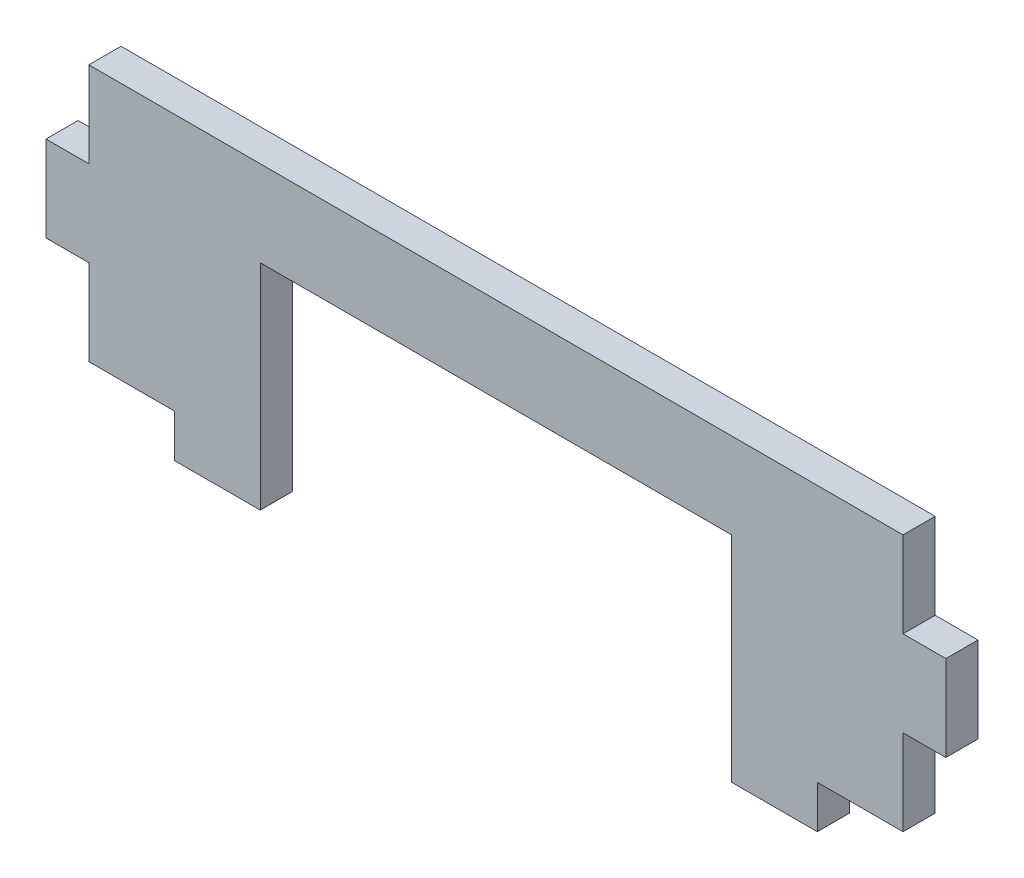
from build123d import *

# Parameters (mm, degrees)
EXTRUDE_1_DEPTH = 3


with BuildPart() as part:
    # 草图1 → 凸台-拉伸1 (new body)
    with BuildSketch(Plane.XY):
        Polygon((-38, 0), (38, 0), (38, -8), (42, -8), (42, -16), (38, -16), (38, -24), (30, -24), (30, -28), (22, -28), (22, -24), (22, -16), (22, -8), (-22, -8), (-22, -16), (-22, -24), (-22, -28), (-30, -28), (-30, -24), (-38, -24), (-38, -16), (-42, -16), (-42, -8), (-38, -8), align=None)
    extrude(amount=EXTRUDE_1_DEPTH)


solid = part.part
